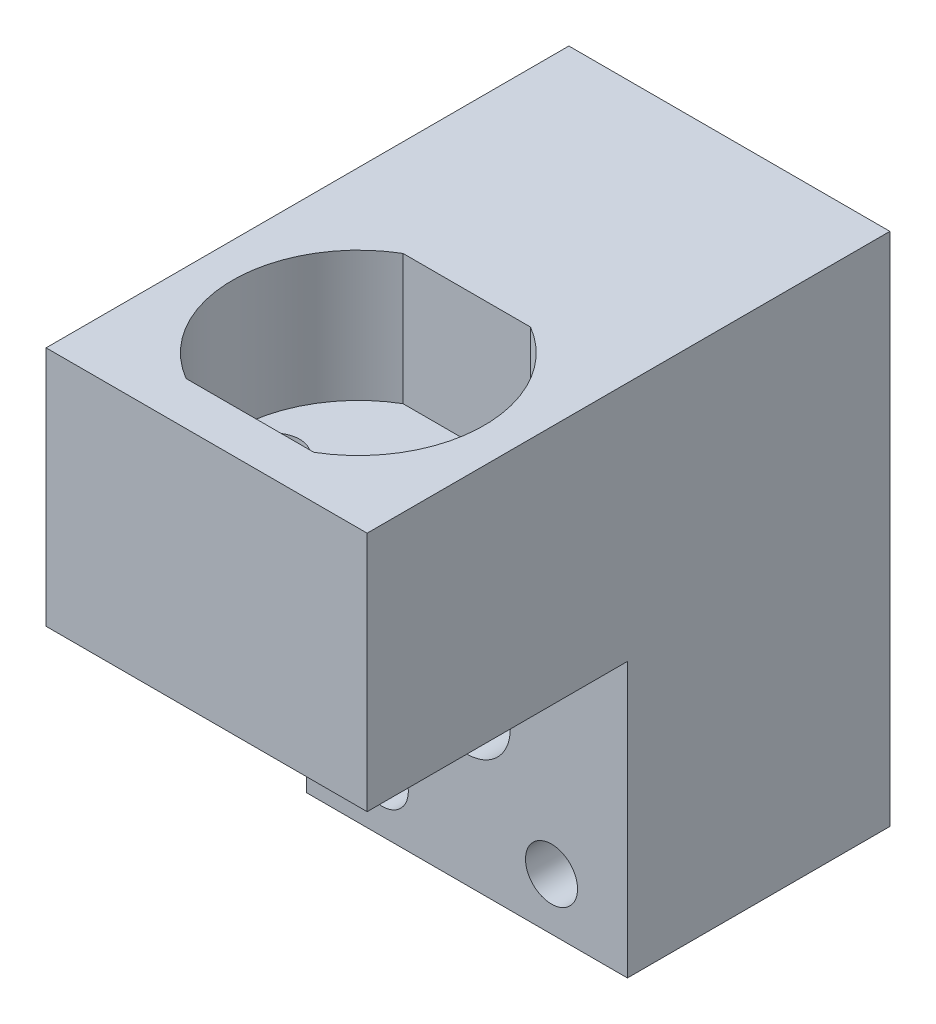
from build123d import *

# Parameters (mm, degrees)
SKETCH_2_W            = 7.400000122
SKETCH_2_H            = 11.88
SKETCH_2_R            = 0.6
EXTRUDE_1_DEPTH       = 6.05
SKETCH_3_W            = 7.400000122
SKETCH_3_H            = 5.56
EXTRUDE_2_DEPTH       = 5
CUT_EXTRUDE_1_DEPTH   = 3
CUT_EXTRUDE_START     = 3
CUT_EXTRUDE_2_DEPTH   = 3
SKETCH_7_R            = 0.6
CUT_EXTRUDE_2_2_DEPTH = 15.655173365
SKETCH_8_R            = 1
CUT_EXTRUDE_3_DEPTH   = 14.261301081
SKETCH_9_W            = 7.400000122
SKETCH_9_H            = 5.56
EXTRUDE_3_DEPTH       = 1


with BuildPart() as part:
    # Эскиз2 → Бобышка-Вытянуть1 (new body)
    with BuildSketch(Plane.XY):
        with Locations((-0.017150241, -0.38)):
            Rectangle(SKETCH_2_W, SKETCH_2_H)
        with Locations((-1.967150241, -5.12)):
            Circle(SKETCH_2_R, mode=Mode.SUBTRACT)
        with Locations((1.932849759, -5.12)):
            Circle(SKETCH_2_R, mode=Mode.SUBTRACT)
    extrude(amount=EXTRUDE_1_DEPTH)

    # Эскиз3 → Бобышка-Вытянуть2 (add)
    with BuildSketch(Plane.XY.offset(6.05)):
        with Locations((-0.017150241, 2.78)):
            Rectangle(SKETCH_3_W, SKETCH_3_H)
    extrude(amount=EXTRUDE_2_DEPTH)

    # Эскиз5 → Вырез-Вытянуть1 (cut)
    with BuildSketch(Plane(origin=(0, 5.56, 0), x_dir=(1, 0, 0), z_dir=(0, 1, 0))):
        with BuildLine():
            Line((-1.018455159, -10.651897729), (-1.374921155, -10.651897729))
            ThreePointArc((-1.374921155, -10.651897729), (-2.518455159, -8.551897729), (-1.374921155, -6.451897729))
            Line((-1.374921155, -6.451897729), (0.581544841, -6.451897729))
            Line((0.581544841, -6.451897729), (0.981544841, -6.451897729))
            Line((0.981544841, -6.451897729), (1.338010838, -6.451897729))
            ThreePointArc((1.338010838, -6.451897729), (2.481544841, -8.551897729), (1.338010838, -10.651897729))
            Line((1.338010838, -10.651897729), (-0.618455159, -10.651897729))
            Line((-0.618455159, -10.651897729), (-1.018455159, -10.651897729))
        make_face()
    extrude(amount=-CUT_EXTRUDE_1_DEPTH, mode=Mode.SUBTRACT)

    # Эскиз6 → Cut-Extrude 2 (cut)
    with BuildSketch(Plane(origin=(0, 2.56, 0), x_dir=(1, 0, 0), z_dir=(0, 1, 0)).offset(CUT_EXTRUDE_START)):
        with BuildLine():
            Line((-1.488149005, -11.051897729), (1.451238687, -11.051897729))
            ThreePointArc((1.451238687, -11.051897729), (2.881544841, -8.551897729), (1.451238687, -6.051897729))
            Line((1.451238687, -6.051897729), (-1.488149005, -6.051897729))
            ThreePointArc((-1.488149005, -6.051897729), (-2.918455159, -8.551897729), (-1.488149005, -11.051897729))
        make_face()
        with BuildLine():
            Line((-1.374921155, -10.651897729), (1.338010838, -10.651897729))
            ThreePointArc((1.338010838, -10.651897729), (2.481544841, -8.551897729), (1.338010838, -6.451897729))
            Line((1.338010838, -6.451897729), (-1.374921155, -6.451897729))
            ThreePointArc((-1.374921155, -6.451897729), (-2.518455159, -8.551897729), (-1.374921155, -10.651897729))
        make_face(mode=Mode.SUBTRACT)
    extrude(amount=-CUT_EXTRUDE_2_DEPTH, mode=Mode.SUBTRACT)

    # Эскиз7 → Cut-Extrude 2 2 (cut, through all)
    with BuildSketch(Plane(origin=(0, 2.56, 0), x_dir=(1, 0, 0), z_dir=(0, 1, 0))):
        with Locations(Location((-1.968455159, -8.551897729, 0), (0, 0, 270))):
            Circle(SKETCH_7_R)
        with Locations(Location((1.931544841, -8.551897729, 0), (0, 0, 270))):
            Circle(SKETCH_7_R)
    extrude(amount=-CUT_EXTRUDE_2_2_DEPTH, mode=Mode.SUBTRACT)

    # Эскиз8 → Вырез-Вытянуть3 (cut, through all)
    with BuildSketch(Plane(origin=(0, 0, 0), x_dir=(-1, 0, 0), z_dir=(0, 0, -1))):
        with Locations((0.017150241, -2.7)):
            Circle(SKETCH_8_R)
    extrude(amount=-CUT_EXTRUDE_3_DEPTH, mode=Mode.SUBTRACT)

    # Эскиз9 → Бобышка-Вытянуть3 (add)
    with BuildSketch(Plane.XY.offset(11.05)):
        with Locations((-0.017150241, 2.78)):
            Rectangle(SKETCH_9_W, SKETCH_9_H)
    extrude(amount=EXTRUDE_3_DEPTH)


solid = part.part
